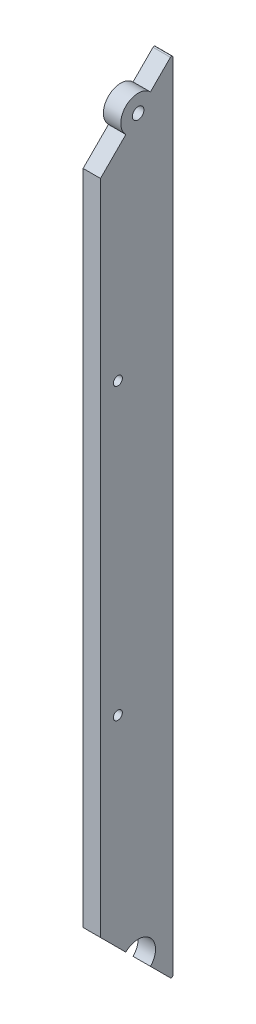
from build123d import *

# Parameters (mm, degrees)
BOSS_EXTRUDE1_DEPTH = 6
FILLET1_R           = 0.5
SKETCH4_R           = 6
BOSS_EXTRUDE2_DEPTH = 6
SKETCH3_R           = 2
SKETCH3_R_2         = 6
CUT_EXTRUDE1_DEPTH  = 284.694910827
CUT_EXTRUDE2_REACH  = 285.695
SKETCH6_R           = 1.55


with BuildPart() as part:
    # Sketch2 → Boss-Extrude1 (new body)
    with BuildSketch(Plane(origin=(0, 0, 0), x_dir=(0, 0, -1), z_dir=(1, 0, 0))):
        Polygon((-30.67492643, 30.67492643), (-30.67492643, 257.67492643), (-5.67492643, 282.67492643), (-5.67492643, 5.67492643), align=None)
    extrude(amount=BOSS_EXTRUDE1_DEPTH)

    # Fillet1
    fillet1_edges = [part.edges().sort_by_distance(p)[0] for p in [
        (3, 282.67492643, 5.67492643),
        (3, 5.67492643, 5.67492643),
    ]]
    fillet(fillet1_edges, radius=FILLET1_R)

    # Sketch4 → Boss-Extrude2 (add)
    with BuildSketch(Plane(origin=(6, 0, 0), x_dir=(0, 0, -1), z_dir=(1, 0, 0))):
        with Locations((-17.67492643, 270.67492643)):
            Circle(SKETCH4_R)
    extrude(amount=-BOSS_EXTRUDE2_DEPTH)

    # Sketch3 → Cut-Extrude1 (cut, through all)
    with BuildSketch(Plane(origin=(6, 0, 0), x_dir=(0, 0, -1), z_dir=(1, 0, 0))):
        with Locations((-17.67492643, 270.67492643)):
            Circle(SKETCH3_R)
        with Locations((-17.67492643, 17.67492643)):
            Circle(SKETCH3_R_2)
    extrude(amount=-CUT_EXTRUDE1_DEPTH, mode=Mode.SUBTRACT)

    # Sketch6 → Cut-Extrude2 (cut, up to next)
    with BuildSketch(Plane(origin=(6, 0, 0), x_dir=(0, 0, -1), z_dir=(1, 0, 0)), mode=Mode.PRIVATE) as cut_extrude2_sk1:
        with Locations((-24.67492643, 94.17492643)):
            Circle(SKETCH6_R)
    cut_extrude2_tool1 = extrude(cut_extrude2_sk1.sketch, amount=-CUT_EXTRUDE2_REACH, mode=Mode.PRIVATE) & part.part
    # Sketch6 → Cut-Extrude2 (cut, up to next)
    with BuildSketch(Plane(origin=(6, 0, 0), x_dir=(0, 0, -1), z_dir=(1, 0, 0)), mode=Mode.PRIVATE) as cut_extrude2_sk2:
        with Locations((-24.67492643, 194.17492643)):
            Circle(SKETCH6_R)
    cut_extrude2_tool2 = extrude(cut_extrude2_sk2.sketch, amount=-CUT_EXTRUDE2_REACH, mode=Mode.PRIVATE) & part.part
    add(cut_extrude2_tool1.solids().sort_by_distance((6, 94.174926, 24.674926))[0], mode=Mode.SUBTRACT)
    add(cut_extrude2_tool2.solids().sort_by_distance((6, 194.174926, 24.674926))[0], mode=Mode.SUBTRACT)


solid = part.part
